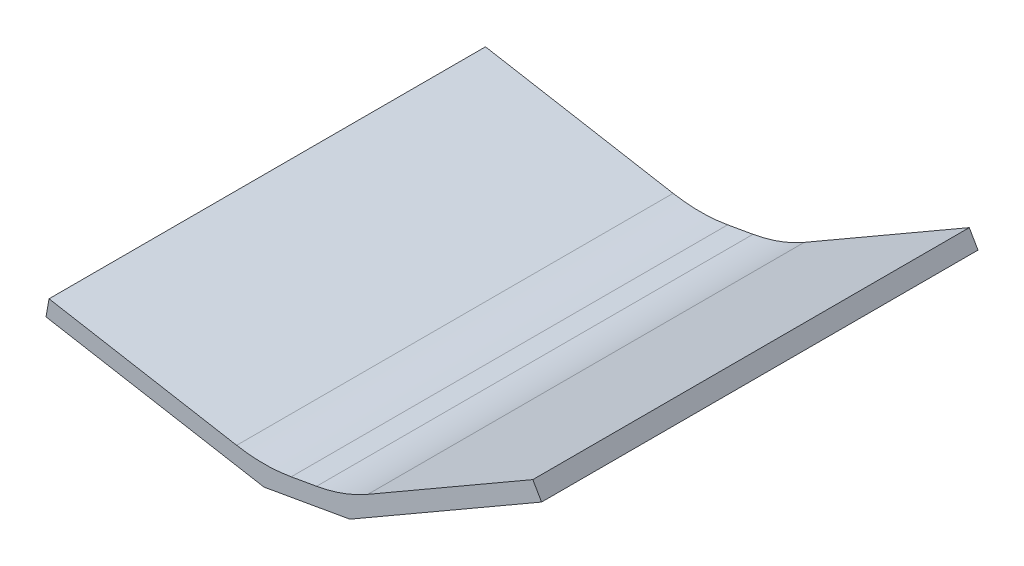
from build123d import *

# Parameters (mm, degrees)
BOSS_EXTRUDE2_DEPTH = 50
FILLET7_R           = 18


with BuildPart() as part:
    # Sketch1 → Boss-Extrude2 (new body)
    with BuildSketch(Plane.XY):
        Polygon((-45.928915918, 4.234674939), (-24.278280823, 16.734674939), (-23.278280823, 15.002624132), (-45.234323207, 2.326297151), (-55.082400737, 0.589815374), (-80.049890918, 4.992257534), (-79.702594562, 6.96187304), (-55.082400737, 2.620668598), align=None)
    extrude(amount=BOSS_EXTRUDE2_DEPTH)

    # Fillet7
    fillet7_edges = [part.edges().sort_by_distance(p)[0] for p in [
        (-55.082400737, 2.620668598, 25),
        (-45.928915918, 4.234674939, 25),
    ]]
    fillet(fillet7_edges, radius=FILLET7_R)


solid = part.part
